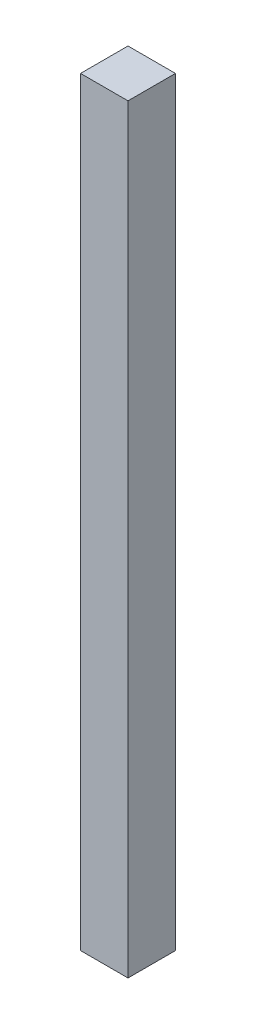
from build123d import *

# Parameters (mm, degrees)
ESQUISSE1_W        = 50
ESQUISSE1_H        = 50
BOSS_EXTRU_1_DEPTH = 800


with BuildPart() as part:
    # Esquisse1 → Boss.-Extru.1 (new body)
    with BuildSketch(Plane(origin=(0, 0, 0), x_dir=(1, 0, 0), z_dir=(0, 1, 0))):
        with Locations((25, 25)):
            Rectangle(ESQUISSE1_W, ESQUISSE1_H)
    extrude(amount=BOSS_EXTRU_1_DEPTH)


solid = part.part
